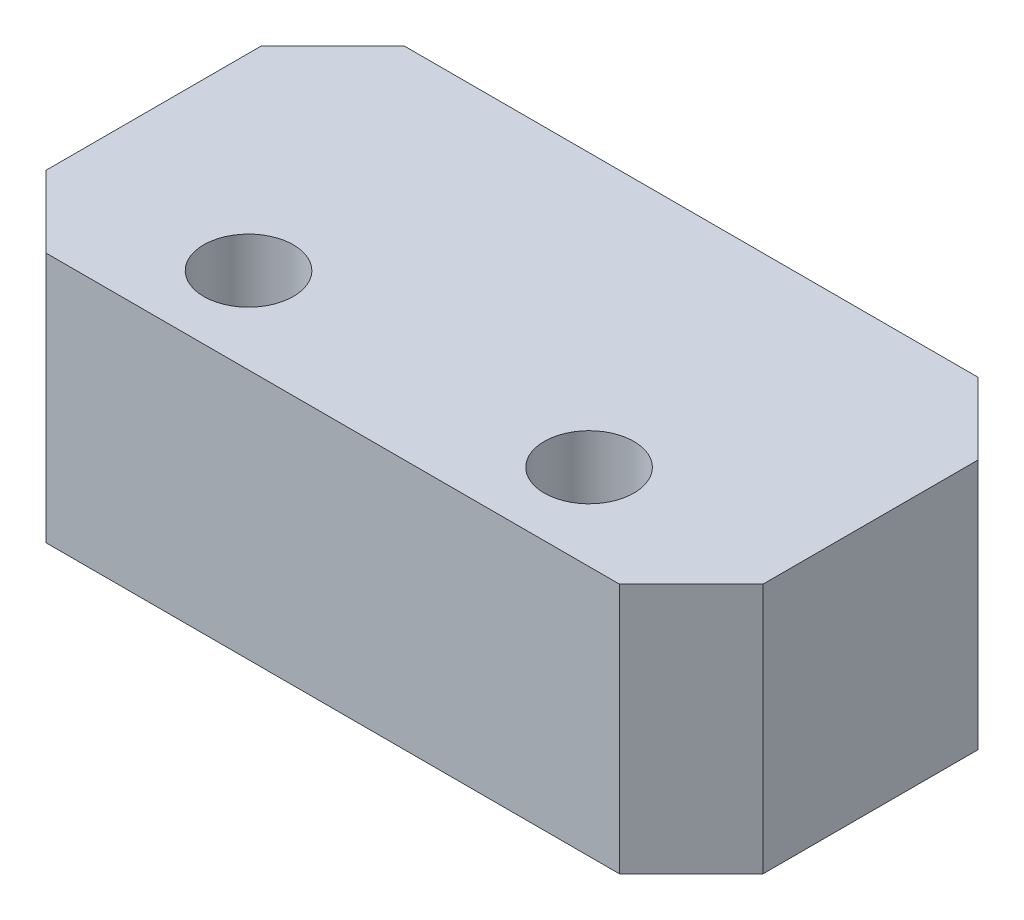
from build123d import *

# Parameters (mm, degrees)
ESQUISSE1_W        = 20
ESQUISSE1_H        = 10
ESQUISSE1_R        = 1.25
BOSS_EXTRU_1_DEPTH = 7
CHANFREIN1_SIZE    = 2


with BuildPart() as part:
    # Esquisse1 → Boss.-Extru.1 (new body)
    with BuildSketch(Plane(origin=(0, 0, 0), x_dir=(1, 0, 0), z_dir=(0, 1, 0))):
        Rectangle(ESQUISSE1_W, ESQUISSE1_H)
        with Locations(Location((4.75, -2.6, 0), (0, 0, 270))):
            Circle(ESQUISSE1_R, mode=Mode.SUBTRACT)
        with Locations(Location((-4.75, -2.6, 0), (0, 0, 270))):
            Circle(ESQUISSE1_R, mode=Mode.SUBTRACT)
    extrude(amount=BOSS_EXTRU_1_DEPTH)

    # Chanfrein1
    chanfrein1_edges = [part.edges().sort_by_distance(p)[0] for p in [
        (10, 3.5, 5),
        (-10, 3.5, 5),
        (-10, 3.5, -5),
        (10, 3.5, -5),
    ]]
    chamfer(chanfrein1_edges, length=CHANFREIN1_SIZE)


solid = part.part
